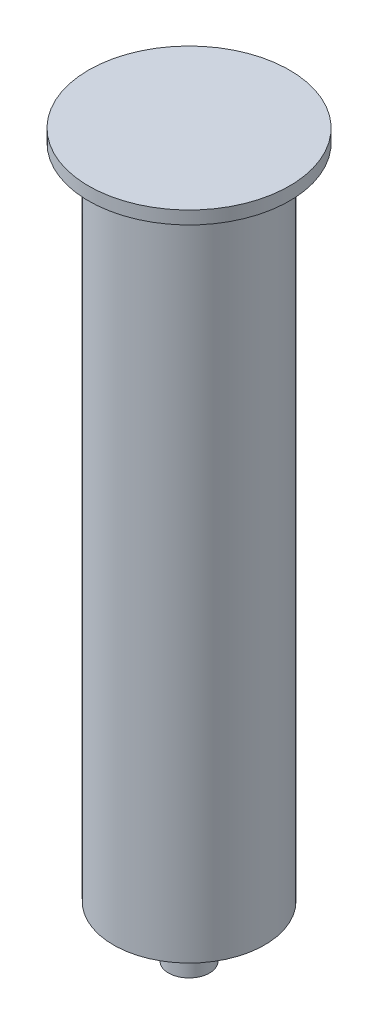
from build123d import *


with BuildPart() as part:
    # Szkic1 → Obrót1 (revolve)
    with BuildSketch(Plane.XY):
        Polygon((0, 0), (-23.25, 0), (-23.25, -3), (-17.5, -3), (-17.5, -155), (-4.75, -160), (-4.75, -167), (0, -167), align=None)
    revolve(axis=Axis((0, 0, 0), (0, -1, 0)))


solid = part.part
